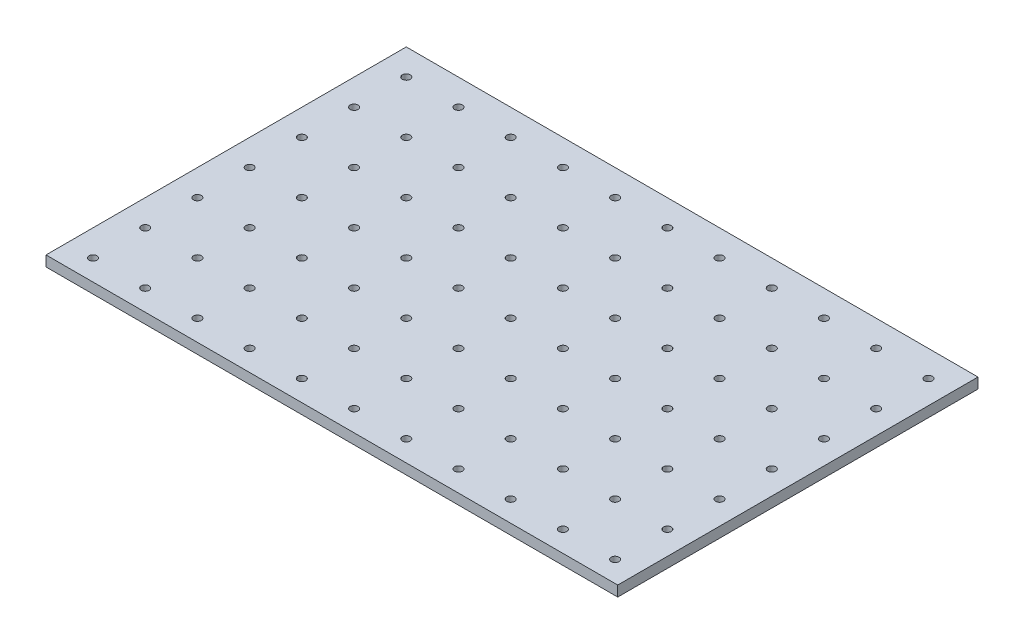
from build123d import *

# Parameters (mm, degrees)
SKETCH1_W           = 219
SKETCH1_H           = 138
BOSS_EXTRUDE1_DEPTH = 4
SKETCH2_R           = 1.5
CUT_EXTRUDE1_DEPTH  = 5


with BuildPart() as part:
    # Sketch1 → Boss-Extrude1 (new body)
    with BuildSketch(Plane(origin=(0, 0, 0), x_dir=(1, 0, 0), z_dir=(0, 1, 0))):
        with Locations((47.534682081, -23.335260116)):
            Rectangle(SKETCH1_W, SKETCH1_H)
    extrude(amount=BOSS_EXTRUDE1_DEPTH)

    # Sketch2 → Cut-Extrude1 (cut)
    with BuildSketch(Plane(origin=(0, 4, 0), x_dir=(1, 0, 0), z_dir=(0, 1, 0))):
        with Locations(Location((-51.965317919, 35.664739884, 0), (0, 0, 270))):
            Circle(SKETCH2_R)
        with Locations(Location((-31.965317919, 35.664739884, 0), (0, 0, 270))):
            Circle(SKETCH2_R)
        with Locations(Location((-11.965317919, 35.664739884, 0), (0, 0, 270))):
            Circle(SKETCH2_R)
        with Locations(Location((8.034682081, 35.664739884, 0), (0, 0, 270))):
            Circle(SKETCH2_R)
        with Locations(Location((28.034682081, 35.664739884, 0), (0, 0, 270))):
            Circle(SKETCH2_R)
        with Locations(Location((48.034682081, 35.664739884, 0), (0, 0, 270))):
            Circle(SKETCH2_R)
        with Locations(Location((68.034682081, 35.664739884, 0), (0, 0, 270))):
            Circle(SKETCH2_R)
        with Locations(Location((88.034682081, 35.664739884, 0), (0, 0, 270))):
            Circle(SKETCH2_R)
        with Locations(Location((108.034682081, 35.664739884, 0), (0, 0, 270))):
            Circle(SKETCH2_R)
        with Locations(Location((128.034682081, 35.664739884, 0), (0, 0, 270))):
            Circle(SKETCH2_R)
        with Locations(Location((148.034682081, 35.664739884, 0), (0, 0, 270))):
            Circle(SKETCH2_R)
        with Locations(Location((-31.965317919, 15.664739884, 0), (0, 0, 270))):
            Circle(SKETCH2_R)
        with Locations(Location((-11.965317919, 15.664739884, 0), (0, 0, 270))):
            Circle(SKETCH2_R)
        with Locations(Location((8.034682081, 15.664739884, 0), (0, 0, 270))):
            Circle(SKETCH2_R)
        with Locations(Location((28.034682081, 15.664739884, 0), (0, 0, 270))):
            Circle(SKETCH2_R)
        with Locations(Location((48.034682081, 15.664739884, 0), (0, 0, 270))):
            Circle(SKETCH2_R)
        with Locations(Location((68.034682081, 15.664739884, 0), (0, 0, 270))):
            Circle(SKETCH2_R)
        with Locations(Location((88.034682081, 15.664739884, 0), (0, 0, 270))):
            Circle(SKETCH2_R)
        with Locations(Location((108.034682081, 15.664739884, 0), (0, 0, 270))):
            Circle(SKETCH2_R)
        with Locations(Location((128.034682081, 15.664739884, 0), (0, 0, 270))):
            Circle(SKETCH2_R)
        with Locations(Location((148.034682081, 15.664739884, 0), (0, 0, 270))):
            Circle(SKETCH2_R)
        with Locations(Location((-31.965317919, -4.335260116, 0), (0, 0, 270))):
            Circle(SKETCH2_R)
        with Locations(Location((-11.965317919, -4.335260116, 0), (0, 0, 270))):
            Circle(SKETCH2_R)
        with Locations(Location((8.034682081, -4.335260116, 0), (0, 0, 270))):
            Circle(SKETCH2_R)
        with Locations(Location((28.034682081, -4.335260116, 0), (0, 0, 270))):
            Circle(SKETCH2_R)
        with Locations(Location((48.034682081, -4.335260116, 0), (0, 0, 270))):
            Circle(SKETCH2_R)
        with Locations(Location((68.034682081, -4.335260116, 0), (0, 0, 270))):
            Circle(SKETCH2_R)
        with Locations(Location((88.034682081, -4.335260116, 0), (0, 0, 270))):
            Circle(SKETCH2_R)
        with Locations(Location((108.034682081, -4.335260116, 0), (0, 0, 270))):
            Circle(SKETCH2_R)
        with Locations(Location((128.034682081, -4.335260116, 0), (0, 0, 270))):
            Circle(SKETCH2_R)
        with Locations(Location((148.034682081, -4.335260116, 0), (0, 0, 270))):
            Circle(SKETCH2_R)
        with Locations(Location((-31.965317919, -24.335260116, 0), (0, 0, 270))):
            Circle(SKETCH2_R)
        with Locations(Location((-11.965317919, -24.335260116, 0), (0, 0, 270))):
            Circle(SKETCH2_R)
        with Locations(Location((8.034682081, -24.335260116, 0), (0, 0, 270))):
            Circle(SKETCH2_R)
        with Locations(Location((28.034682081, -24.335260116, 0), (0, 0, 270))):
            Circle(SKETCH2_R)
        with Locations(Location((48.034682081, -24.335260116, 0), (0, 0, 270))):
            Circle(SKETCH2_R)
        with Locations(Location((68.034682081, -24.335260116, 0), (0, 0, 270))):
            Circle(SKETCH2_R)
        with Locations(Location((88.034682081, -24.335260116, 0), (0, 0, 270))):
            Circle(SKETCH2_R)
        with Locations(Location((108.034682081, -24.335260116, 0), (0, 0, 270))):
            Circle(SKETCH2_R)
        with Locations(Location((128.034682081, -24.335260116, 0), (0, 0, 270))):
            Circle(SKETCH2_R)
        with Locations(Location((148.034682081, -24.335260116, 0), (0, 0, 270))):
            Circle(SKETCH2_R)
        with Locations(Location((-31.965317919, -44.335260116, 0), (0, 0, 270))):
            Circle(SKETCH2_R)
        with Locations(Location((-11.965317919, -44.335260116, 0), (0, 0, 270))):
            Circle(SKETCH2_R)
        with Locations(Location((8.034682081, -44.335260116, 0), (0, 0, 270))):
            Circle(SKETCH2_R)
        with Locations(Location((28.034682081, -44.335260116, 0), (0, 0, 270))):
            Circle(SKETCH2_R)
        with Locations(Location((48.034682081, -44.335260116, 0), (0, 0, 270))):
            Circle(SKETCH2_R)
        with Locations(Location((68.034682081, -44.335260116, 0), (0, 0, 270))):
            Circle(SKETCH2_R)
        with Locations(Location((88.034682081, -44.335260116, 0), (0, 0, 270))):
            Circle(SKETCH2_R)
        with Locations(Location((108.034682081, -44.335260116, 0), (0, 0, 270))):
            Circle(SKETCH2_R)
        with Locations(Location((128.034682081, -44.335260116, 0), (0, 0, 270))):
            Circle(SKETCH2_R)
        with Locations(Location((148.034682081, -44.335260116, 0), (0, 0, 270))):
            Circle(SKETCH2_R)
        with Locations(Location((-31.965317919, -64.335260116, 0), (0, 0, 270))):
            Circle(SKETCH2_R)
        with Locations(Location((-11.965317919, -64.335260116, 0), (0, 0, 270))):
            Circle(SKETCH2_R)
        with Locations(Location((8.034682081, -64.335260116, 0), (0, 0, 270))):
            Circle(SKETCH2_R)
        with Locations(Location((28.034682081, -64.335260116, 0), (0, 0, 270))):
            Circle(SKETCH2_R)
        with Locations(Location((48.034682081, -64.335260116, 0), (0, 0, 270))):
            Circle(SKETCH2_R)
        with Locations(Location((68.034682081, -64.335260116, 0), (0, 0, 270))):
            Circle(SKETCH2_R)
        with Locations(Location((88.034682081, -64.335260116, 0), (0, 0, 270))):
            Circle(SKETCH2_R)
        with Locations(Location((108.034682081, -64.335260116, 0), (0, 0, 270))):
            Circle(SKETCH2_R)
        with Locations(Location((128.034682081, -64.335260116, 0), (0, 0, 270))):
            Circle(SKETCH2_R)
        with Locations(Location((148.034682081, -64.335260116, 0), (0, 0, 270))):
            Circle(SKETCH2_R)
        with Locations(Location((-31.965317919, -84.335260116, 0), (0, 0, 270))):
            Circle(SKETCH2_R)
        with Locations(Location((-11.965317919, -84.335260116, 0), (0, 0, 270))):
            Circle(SKETCH2_R)
        with Locations(Location((8.034682081, -84.335260116, 0), (0, 0, 270))):
            Circle(SKETCH2_R)
        with Locations(Location((28.034682081, -84.335260116, 0), (0, 0, 270))):
            Circle(SKETCH2_R)
        with Locations(Location((48.034682081, -84.335260116, 0), (0, 0, 270))):
            Circle(SKETCH2_R)
        with Locations(Location((68.034682081, -84.335260116, 0), (0, 0, 270))):
            Circle(SKETCH2_R)
        with Locations(Location((88.034682081, -84.335260116, 0), (0, 0, 270))):
            Circle(SKETCH2_R)
        with Locations(Location((108.034682081, -84.335260116, 0), (0, 0, 270))):
            Circle(SKETCH2_R)
        with Locations(Location((128.034682081, -84.335260116, 0), (0, 0, 270))):
            Circle(SKETCH2_R)
        with Locations(Location((148.034682081, -84.335260116, 0), (0, 0, 270))):
            Circle(SKETCH2_R)
        with Locations(Location((-51.965317919, 15.664739884, 0), (0, 0, 270))):
            Circle(SKETCH2_R)
        with Locations(Location((-51.965317919, -4.335260116, 0), (0, 0, 270))):
            Circle(SKETCH2_R)
        with Locations(Location((-51.965317919, -24.335260116, 0), (0, 0, 270))):
            Circle(SKETCH2_R)
        with Locations(Location((-51.965317919, -44.335260116, 0), (0, 0, 270))):
            Circle(SKETCH2_R)
        with Locations(Location((-51.965317919, -64.335260116, 0), (0, 0, 270))):
            Circle(SKETCH2_R)
        with Locations(Location((-51.965317919, -84.335260116, 0), (0, 0, 270))):
            Circle(SKETCH2_R)
    extrude(amount=-CUT_EXTRUDE1_DEPTH, mode=Mode.SUBTRACT)


solid = part.part
